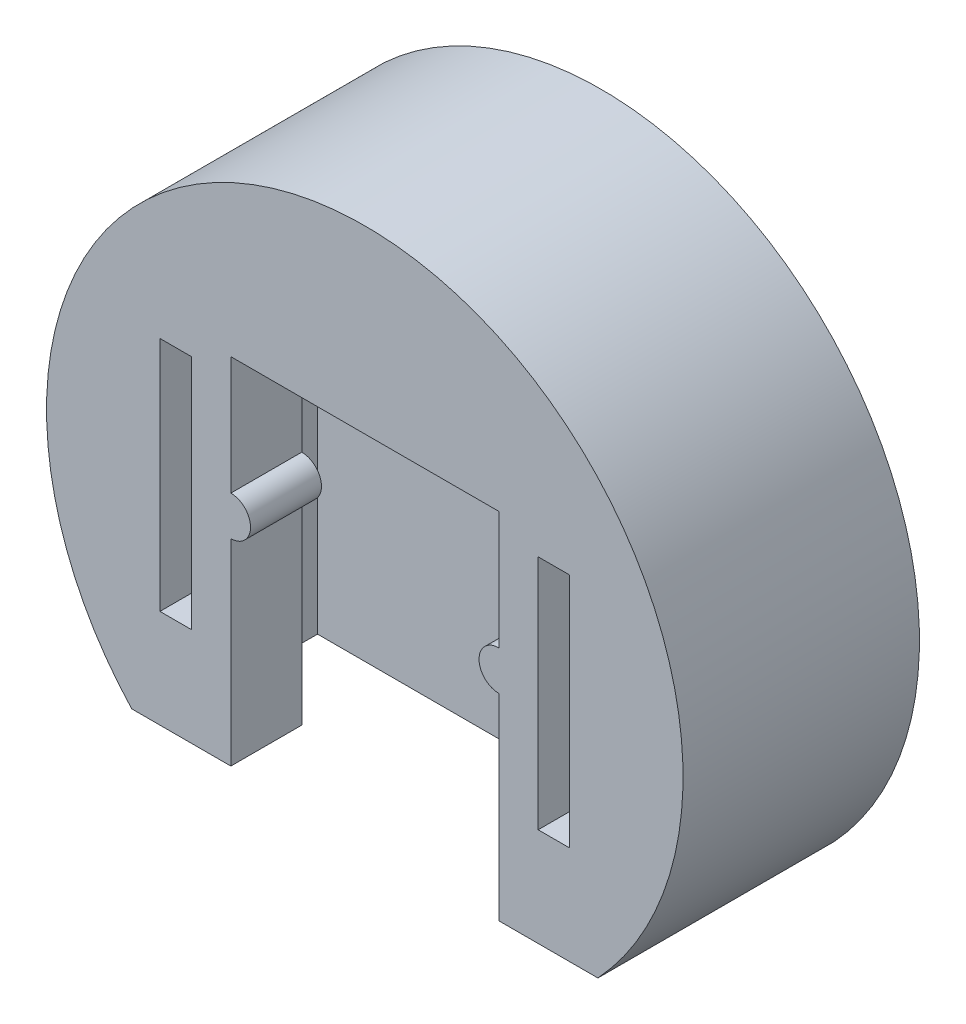
from build123d import *

# Parameters (mm, degrees)
BOSS_EXTRUDE1_DEPTH = 6
SKETCH2_W           = 6.8
SKETCH2_H           = 9
CUT_EXTRUDE1_DEPTH  = 4
SKETCH3_W           = 10.4
SKETCH3_H           = 10.6
CUT_EXTRUDE2_DEPTH  = 2.2
SKETCH4_W           = 0.8
SKETCH4_H           = 6
CUT_EXTRUDE3_DEPTH  = 2.2
SKETCH5_R           = 0.5
BOSS_EXTRUDE2_DEPTH = 1.8
FILLET1_R           = 0.5


with BuildPart() as part:
    # Sketch1 → Boss-Extrude1 (new body)
    with BuildSketch(Plane.XY):
        with BuildLine():
            Line((5.916079783, -5.5), (-5.916079783, -5.5))
            ThreePointArc((-5.916079783, -5.5), (0, 8.077747211), (5.916079783, -5.5))
        make_face()
    extrude(amount=BOSS_EXTRUDE1_DEPTH)

    # Sketch2 → Cut-Extrude1 (cut)
    with BuildSketch(Plane.XY.offset(6)):
        with Locations((0, -1)):
            Rectangle(SKETCH2_W, SKETCH2_H)
    extrude(amount=-CUT_EXTRUDE1_DEPTH, mode=Mode.SUBTRACT)

    # Sketch3 → Cut-Extrude2 (cut)
    with BuildSketch(Plane.XY.offset(2)):
        with Locations((0, -0.2)):
            Rectangle(SKETCH3_W, SKETCH3_H)
    extrude(amount=CUT_EXTRUDE2_DEPTH, mode=Mode.SUBTRACT)

    # Sketch4 → Cut-Extrude3 (cut)
    with BuildSketch(Plane.XY.offset(6)):
        with Locations((-4.8, 0)):
            Rectangle(SKETCH4_W, SKETCH4_H)
        with Locations((4.8, 0)):
            Rectangle(SKETCH4_W, SKETCH4_H)
    extrude(amount=-CUT_EXTRUDE3_DEPTH, mode=Mode.SUBTRACT)

    # Sketch5 → Boss-Extrude2 (add)
    with BuildSketch(Plane.XY.offset(6)):
        with Locations((-3.4, 0)):
            Circle(SKETCH5_R)
        with Locations((3.4, 0)):
            Circle(SKETCH5_R)
    extrude(amount=-BOSS_EXTRUDE2_DEPTH)

    # Fillet1
    fillet1_edges = [part.edges().sort_by_distance(p)[0] for p in [
        (-5.2, 5.1, 3.1),
        (5.2, 5.1, 3.1),
    ]]
    fillet(fillet1_edges, radius=FILLET1_R)


solid = part.part
